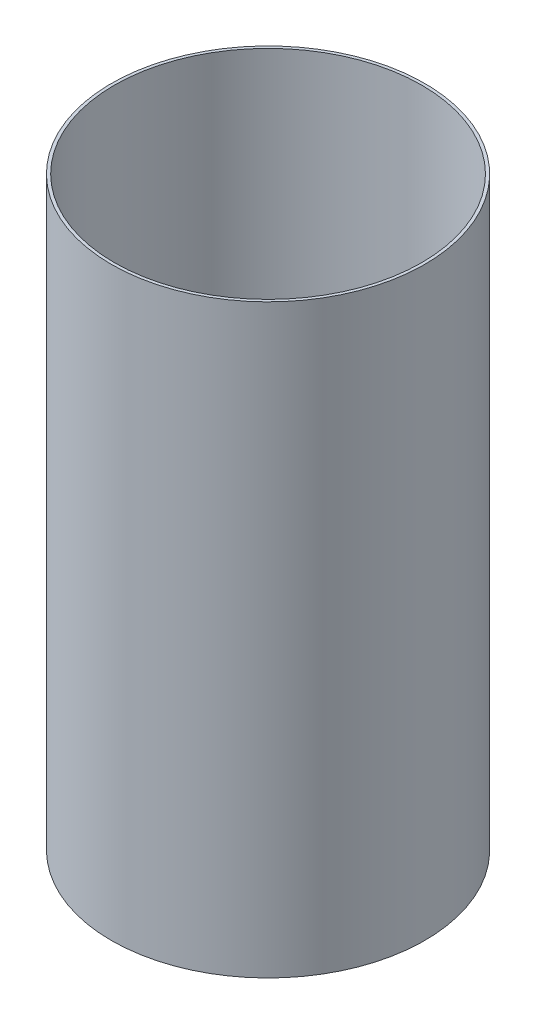
from build123d import *

# Parameters (mm, degrees)
SKETCH2_R           = 74.7776
SKETCH2_R_2         = 73.3552
BOSS_EXTRUDE1_DEPTH = 139.7


with BuildPart() as part:
    # Sketch2 → Boss-Extrude1 (new, symmetric)
    with BuildSketch(Plane(origin=(0, 0, 0), x_dir=(1, 0, 0), z_dir=(0, 1, 0))):
        with Locations(Location((0, 0, 0), (0, 0, 270))):
            Circle(SKETCH2_R)
        with Locations(Location((0, 0, 0), (0, 0, 270))):
            Circle(SKETCH2_R_2, mode=Mode.SUBTRACT)
    extrude(amount=BOSS_EXTRUDE1_DEPTH, both=True)


solid = part.part
